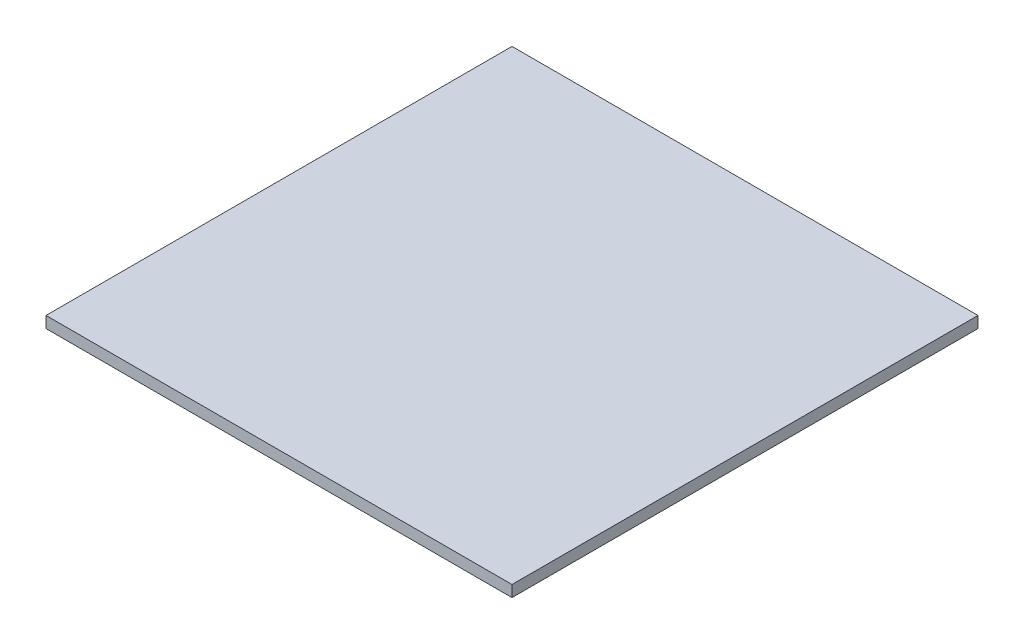
from build123d import *

# Parameters (mm, degrees)
SKETCH2_W           = 1041.4
SKETCH2_H           = 1041.4
BOSS_EXTRUDE1_DEPTH = 25.4


with BuildPart() as part:
    # Sketch2 → Boss-Extrude1 (new body)
    with BuildSketch(Plane(origin=(0, 0, 0), x_dir=(1, 0, 0), z_dir=(0, 1, 0))):
        Rectangle(SKETCH2_W, SKETCH2_H)
    extrude(amount=BOSS_EXTRUDE1_DEPTH)


solid = part.part
